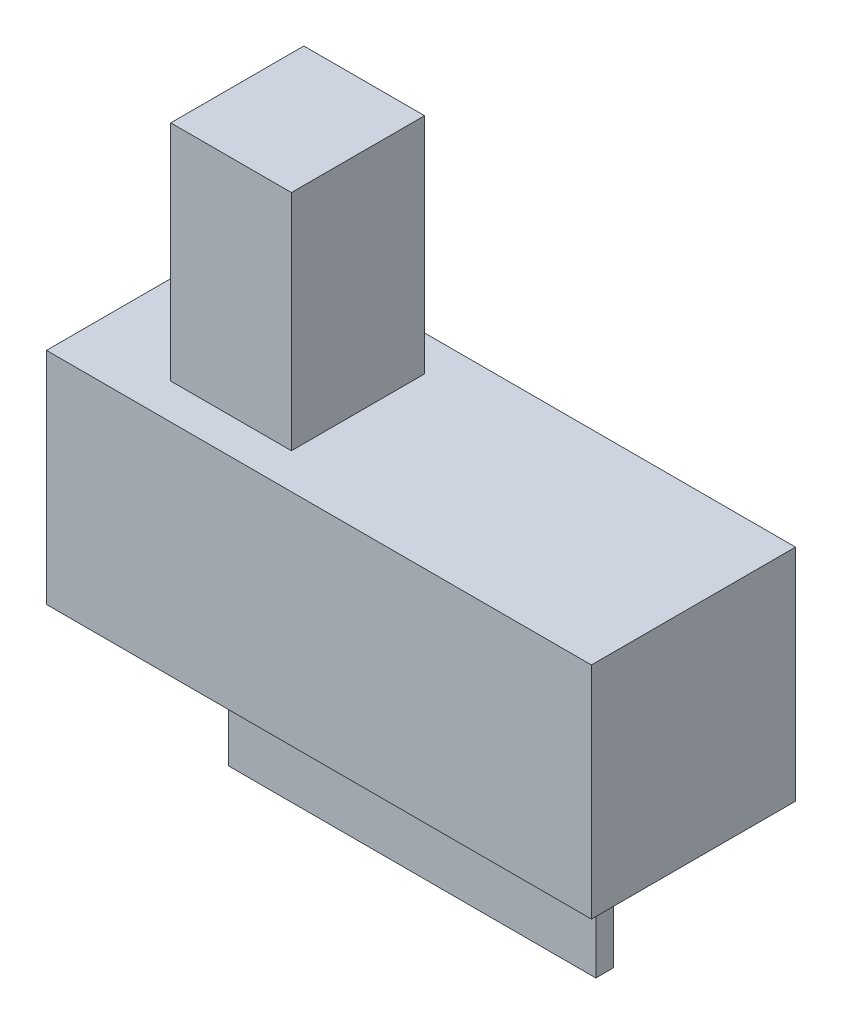
from build123d import *

# Parameters (mm, degrees)
ESBO_O2_W                = 15.35
ESBO_O2_H                = 5.75
RESSALTO_EXTRUS_O1_DEPTH = 6.2
ESBO_O2_3_W              = 3.4
ESBO_O2_3_H              = 3.75
RESSALTO_EXTRUS_O2_DEPTH = 6.3
RESSALTO_EXTRUS_O3_DEPTH = 4


with BuildPart() as part:
    # Esboço2 → Ressalto-extrusão1 (new body)
    with BuildSketch(Plane(origin=(0, 0, 0), x_dir=(1, 0, 0), z_dir=(0, 1, 0))):
        with Locations((7.675, 2.875)):
            Rectangle(ESBO_O2_W, ESBO_O2_H)
    extrude(amount=-RESSALTO_EXTRUS_O1_DEPTH)

    # Esboço2<3> → Ressalto-extrusão2 (add)
    with BuildSketch(Plane(origin=(0, 0, 0), x_dir=(1, 0, 0), z_dir=(0, 1, 0))):
        with Locations((4.2, 2.875)):
            Rectangle(ESBO_O2_3_W, ESBO_O2_3_H)
    extrude(amount=RESSALTO_EXTRUS_O2_DEPTH)

    # Esboço3 → Ressalto-extrusão3 (add)
    with BuildSketch(Plane.XZ.offset(6.2)):
        Polygon((2.5, -2.875), (2.5, -2.625), (12.85, -2.625), (12.85, -2.875), (12.85, -3.125), (2.5, -3.125), align=None)
    extrude(amount=RESSALTO_EXTRUS_O3_DEPTH)


solid = part.part
